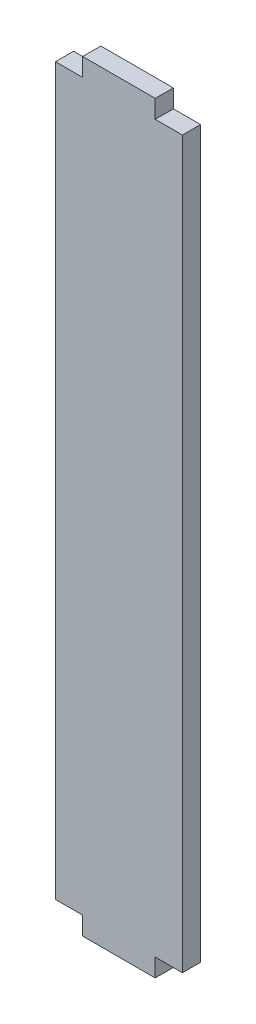
from build123d import *

# Parameters (mm, degrees)
SKETCH1_W           = 35
SKETCH1_H           = 200
SKETCH1_W_2         = 20
SKETCH1_H_2         = 5
BOSS_EXTRUDE1_DEPTH = 5


with BuildPart() as part:
    # Sketch1 → Boss-Extrude1 (new body)
    with BuildSketch(Plane.XY):
        with Locations((-17.5, -100)):
            Rectangle(SKETCH1_W, SKETCH1_H)
        with Locations((-17.5, 2.5)):
            Rectangle(SKETCH1_W_2, SKETCH1_H_2)
        with Locations((-17.5, -202.5)):
            Rectangle(SKETCH1_W_2, SKETCH1_H_2)
    extrude(amount=BOSS_EXTRUDE1_DEPTH)


solid = part.part
